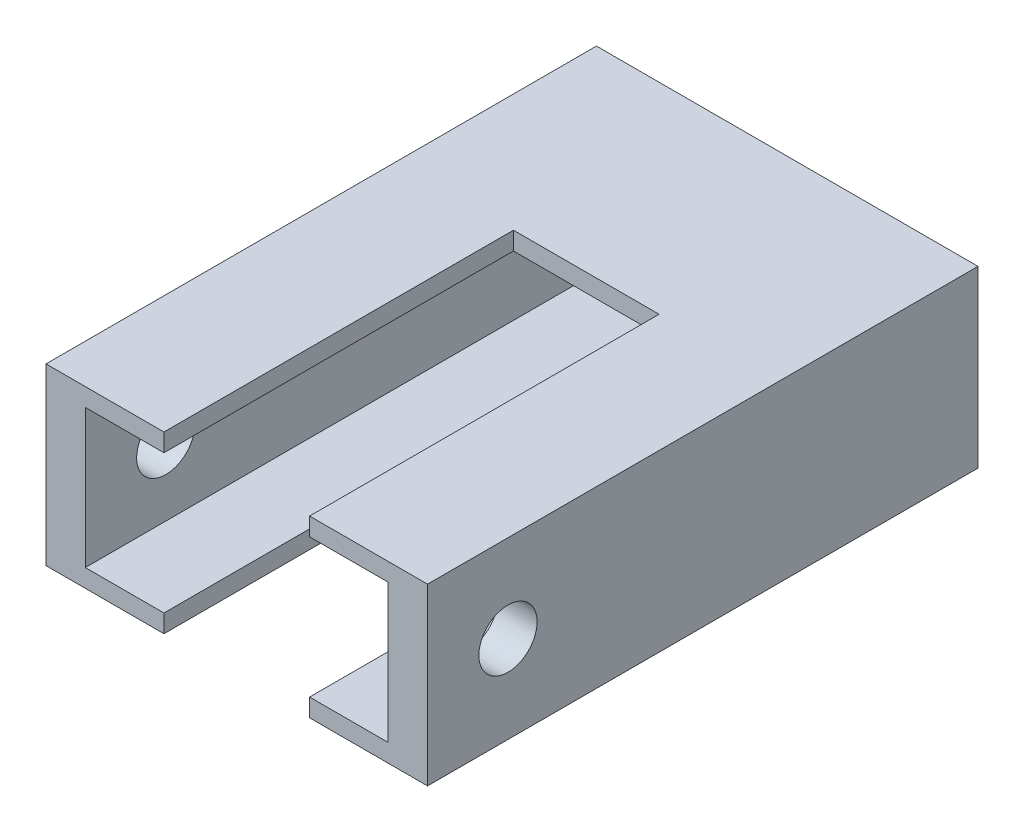
from build123d import *

# Parameters (mm, degrees)
SKETCH2_W           = 65.5
SKETCH2_H           = 30
SKETCH2_W_2         = 52
SKETCH2_H_2         = 23.816793894
BOSS_EXTRUDE1_DEPTH = 94.5
SKETCH3_W           = 52
SKETCH3_H           = 23.816793894
BOSS_EXTRUDE2_DEPTH = 10
SKETCH4_W           = 25
SKETCH4_H           = 30
CUT_EXTRUDE1_DEPTH  = 60
SKETCH5_R           = 5
CUT_EXTRUDE2_DEPTH  = 116.954732547
SKETCH6_R           = 5
CUT_EXTRUDE3_DEPTH  = 102.132648042


with BuildPart() as part:
    # Sketch2 → Boss-Extrude1 (new body)
    with BuildSketch(Plane.XY):
        Rectangle(SKETCH2_W, SKETCH2_H)
        Rectangle(SKETCH2_W_2, SKETCH2_H_2, mode=Mode.SUBTRACT)
    extrude(amount=BOSS_EXTRUDE1_DEPTH)

    # Sketch3 → Boss-Extrude2 (add)
    with BuildSketch(Plane(origin=(0, 0, 0), x_dir=(-1, 0, 0), z_dir=(0, 0, -1))):
        Rectangle(SKETCH3_W, SKETCH3_H)
    extrude(amount=-BOSS_EXTRUDE2_DEPTH)

    # Sketch4 → Cut-Extrude1 (cut)
    with BuildSketch(Plane.XY.offset(94.5)):
        Rectangle(SKETCH4_W, SKETCH4_H)
    extrude(amount=-CUT_EXTRUDE1_DEPTH, mode=Mode.SUBTRACT)

    # Sketch5 → Cut-Extrude2 (cut, through all)
    with BuildSketch(Plane.ZY.offset(32.75)):
        with Locations(Location((80.690823626, 0, 0), (0, 0, 270))):
            Circle(SKETCH5_R)
    extrude(amount=-CUT_EXTRUDE2_DEPTH, mode=Mode.SUBTRACT)

    # Sketch6 → Cut-Extrude3 (cut, through all)
    with BuildSketch(Plane(origin=(0, 0, 0), x_dir=(-1, 0, 0), z_dir=(0, 0, -1))):
        Circle(SKETCH6_R)
    extrude(amount=-CUT_EXTRUDE3_DEPTH, mode=Mode.SUBTRACT)


solid = part.part
